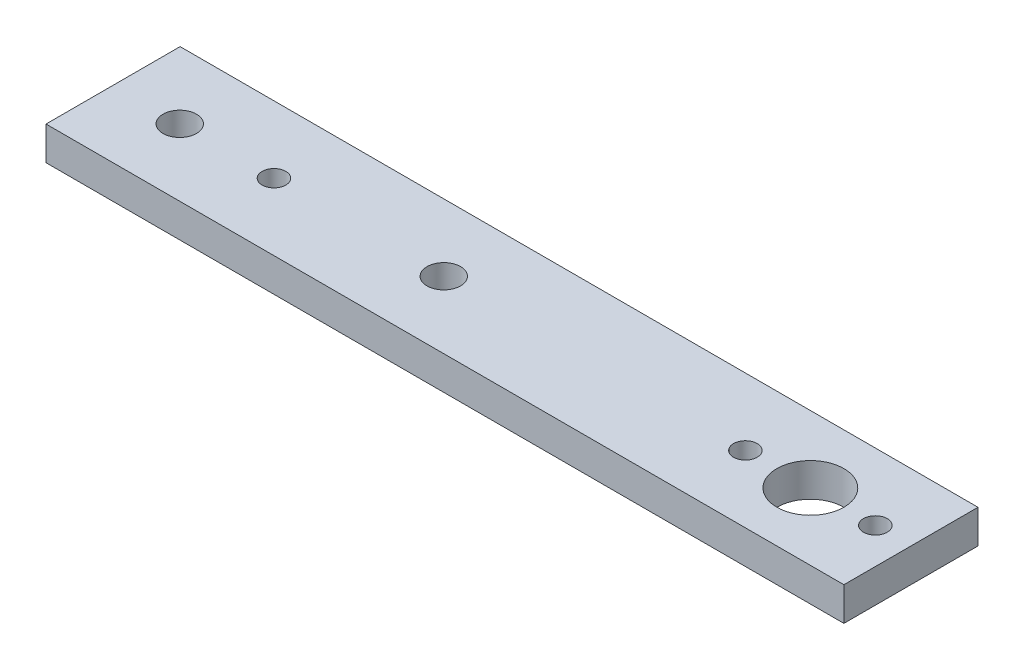
from build123d import *

# Parameters (mm, degrees)
SKETCH1_W           = 69.85
SKETCH1_H           = 25.4
SKETCH1_R           = 6.35
BOSS_EXTRUDE1_DEPTH = 6.35
SKETCH3_W           = 81.28
SKETCH3_H           = 25.4
BOSS_EXTRUDE2_DEPTH = 6.35
SKETCH4_R           = 3.175
SKETCH4_R_2         = 2.2479
CUT_EXTRUDE2_DEPTH  = 118.069272335
SKETCH5_R           = 2.2479
CUT_EXTRUDE3_DEPTH  = 118.069272335


with BuildPart() as part:
    # Sketch1 → Boss-Extrude1 (new body)
    with BuildSketch(Plane(origin=(0, 0, 0), x_dir=(1, 0, 0), z_dir=(0, 1, 0))):
        Rectangle(SKETCH1_W, SKETCH1_H)
        with Locations(Location((15.875, 0, 0), (0, 0, 270))):
            Circle(SKETCH1_R, mode=Mode.SUBTRACT)
    extrude(amount=BOSS_EXTRUDE1_DEPTH)

    # Sketch3 → Boss-Extrude2 (add)
    with BuildSketch(Plane.XZ):
        with Locations((-75.565, 0)):
            Rectangle(SKETCH3_W, SKETCH3_H)
    extrude(amount=-BOSS_EXTRUDE2_DEPTH)

    # Sketch4 → Cut-Extrude2 (cut, through all)
    with BuildSketch(Plane.XZ):
        with Locations(Location((-53.55992209, 0, 0), (0, 0, 270))):
            Circle(SKETCH4_R)
        with Locations(Location((-85.725, 0, 0), (0, 0, 270))):
            Circle(SKETCH4_R_2)
        with Locations(Location((-103.5685508, 0, 0), (0, 0, 270))):
            Circle(SKETCH4_R)
    extrude(amount=-CUT_EXTRUDE2_DEPTH, mode=Mode.SUBTRACT)

    # Sketch5 → Cut-Extrude3 (cut, through all)
    with BuildSketch(Plane.XZ):
        with Locations(Location((28.1813, 0, 0), (0, 0, 270))):
            Circle(SKETCH5_R)
        with Locations(Location((3.5687, 0, 0), (0, 0, 270))):
            Circle(SKETCH5_R)
    extrude(amount=-CUT_EXTRUDE3_DEPTH, mode=Mode.SUBTRACT)


solid = part.part
